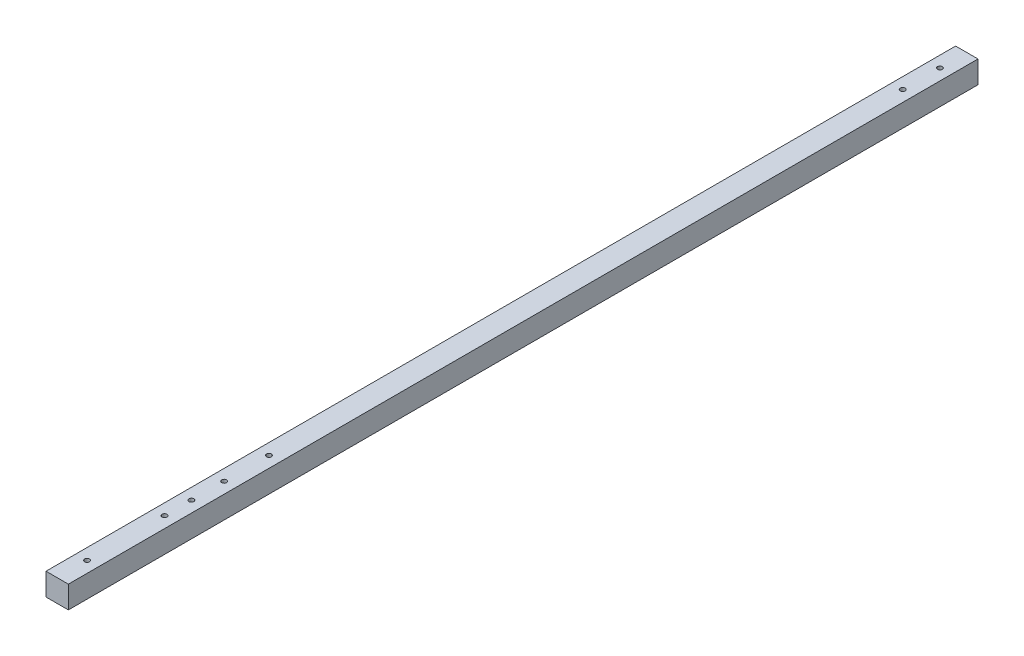
from build123d import *

# Parameters (mm, degrees)
SKETCH_1_W          = 15
SKETCH_1_H          = 15
EXTRUDE_1_DEPTH     = 610
SKETCH_2_R          = 1.65
CUT_EXTRUDE_1_DEPTH = 20


with BuildPart() as part:
    # 草图1 → 凸台-拉伸1 (new body)
    with BuildSketch(Plane.XY):
        Rectangle(SKETCH_1_W, SKETCH_1_H)
    extrude(amount=EXTRUDE_1_DEPTH)

    # 草图2 → 切除-拉伸1 (cut)
    with BuildSketch(Plane(origin=(0, 7.5, 0), x_dir=(1, 0, 0), z_dir=(0, 1, 0))):
        with Locations(Location((0, -590, 0), (0, 0, 270))):
            Circle(SKETCH_2_R)
        with Locations(Location((0, -520, 0), (0, 0, 270))):
            Circle(SKETCH_2_R)
        with Locations(Location((0, -18, 0), (0, 0, 270))):
            Circle(SKETCH_2_R)
        with Locations(Location((0, -43, 0), (0, 0, 270))):
            Circle(SKETCH_2_R)
        with Locations(Location((0, -498, 0), (0, 0, 270))):
            Circle(SKETCH_2_R)
        with Locations(Location((0, -538, 0), (0, 0, 270))):
            Circle(SKETCH_2_R)
        with Locations(Location((0, -468, 0), (0, 0, 270))):
            Circle(SKETCH_2_R)
    extrude(amount=-CUT_EXTRUDE_1_DEPTH, mode=Mode.SUBTRACT)


solid = part.part
